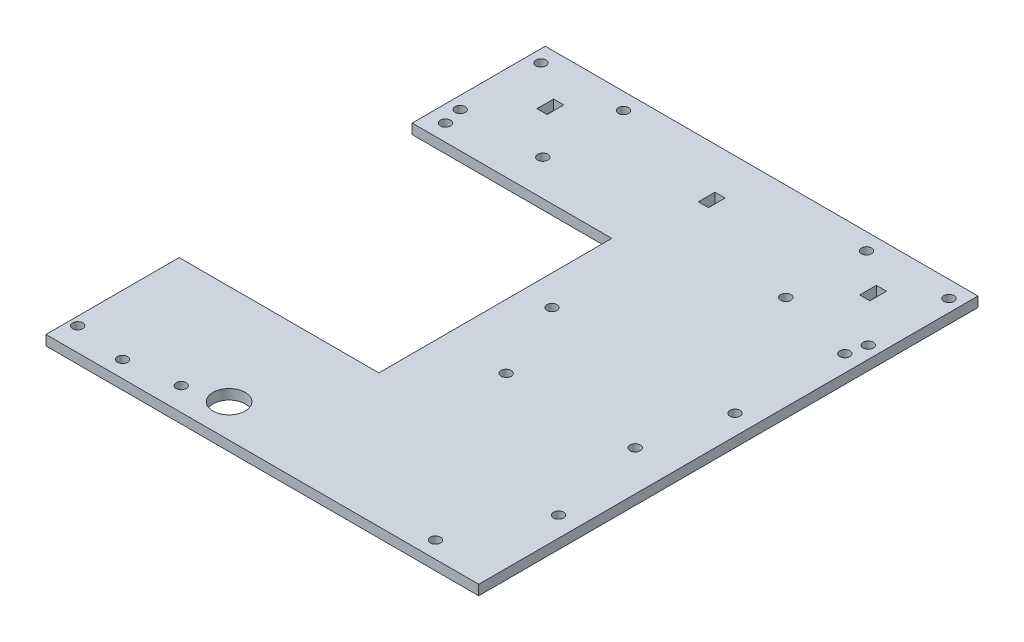
from build123d import *

# Parameters (mm, degrees)
SKETCH1_R           = 1.525
SKETCH1_R_2         = 4.85
SKETCH1_W           = 3.05
SKETCH1_H           = 5
BOSS_EXTRUDE1_DEPTH = 3


with BuildPart() as part:
    # Sketch1 → Boss-Extrude1 (new body)
    with BuildSketch(Plane(origin=(0, 0, 0), x_dir=(1, 0, 0), z_dir=(0, 1, 0))):
        Polygon((-65, -75), (65, -75), (65, -52.5), (65, -47.5), (65, 75), (-65, 75), (-65, 35), (-5, 35), (-5, -35), (-65, -35), (-65, -47.5), (-65, -52.5), align=None)
        with Locations(Location((-61.3, 70, 0), (0, 0, 270))):
            Circle(SKETCH1_R, mode=Mode.SUBTRACT)
        with Locations(Location((-61.3, 45.74, 0), (0, 0, 270))):
            Circle(SKETCH1_R, mode=Mode.SUBTRACT)
        with Locations(Location((-36.5, 70, 0), (0, 0, 270))):
            Circle(SKETCH1_R, mode=Mode.SUBTRACT)
        with Locations(Location((-36.5, 45.74, 0), (0, 0, 270))):
            Circle(SKETCH1_R, mode=Mode.SUBTRACT)
        with Locations(Location((36.5, 45.74, 0), (0, 0, 270))):
            Circle(SKETCH1_R, mode=Mode.SUBTRACT)
        with Locations(Location((36.5, 70, 0), (0, 0, 270))):
            Circle(SKETCH1_R, mode=Mode.SUBTRACT)
        with Locations(Location((61.3, 45.74, 0), (0, 0, 270))):
            Circle(SKETCH1_R, mode=Mode.SUBTRACT)
        with Locations(Location((61.3, 70, 0), (0, 0, 270))):
            Circle(SKETCH1_R, mode=Mode.SUBTRACT)
        with Locations(Location((-47, -70, 0), (0, 0, 270))):
            Circle(SKETCH1_R, mode=Mode.SUBTRACT)
        with Locations(Location((47, -70, 0), (0, 0, 270))):
            Circle(SKETCH1_R, mode=Mode.SUBTRACT)
        with Locations(Location((-60, 40, 0), (0, 0, 270))):
            Circle(SKETCH1_R, mode=Mode.SUBTRACT)
        with Locations(Location((60, 40, 0), (0, 0, 270))):
            Circle(SKETCH1_R, mode=Mode.SUBTRACT)
        with Locations(Location((59, -45, 0), (0, 0, 270))):
            Circle(SKETCH1_R, mode=Mode.SUBTRACT)
        with Locations(Location((4, 8, 0), (0, 0, 270))):
            Circle(SKETCH1_R, mode=Mode.SUBTRACT)
        with Locations(Location((59, 8, 0), (0, 0, 270))):
            Circle(SKETCH1_R, mode=Mode.SUBTRACT)
        with Locations(Location((53, -16, 0), (0, 0, 270))):
            Circle(SKETCH1_R, mode=Mode.SUBTRACT)
        with Locations(Location((14.24, -16, 0), (0, 0, 270))):
            Circle(SKETCH1_R, mode=Mode.SUBTRACT)
        with Locations(Location((-62.5, -68, 0), (0, 0, 270))):
            Circle(SKETCH1_R, mode=Mode.SUBTRACT)
        with Locations(Location((-31.37, -68, 0), (0, 0, 270))):
            Circle(SKETCH1_R, mode=Mode.SUBTRACT)
        with Locations(Location((-20, -65, 0), (0, 0, 270))):
            Circle(SKETCH1_R_2, mode=Mode.SUBTRACT)
        with Locations((48.475, 60)):
            Rectangle(SKETCH1_W, SKETCH1_H, mode=Mode.SUBTRACT)
        with Locations((-48.475, 60)):
            Rectangle(SKETCH1_W, SKETCH1_H, mode=Mode.SUBTRACT)
        with Locations((0, 60)):
            Rectangle(SKETCH1_W, SKETCH1_H, mode=Mode.SUBTRACT)
    extrude(amount=BOSS_EXTRUDE1_DEPTH)


solid = part.part
